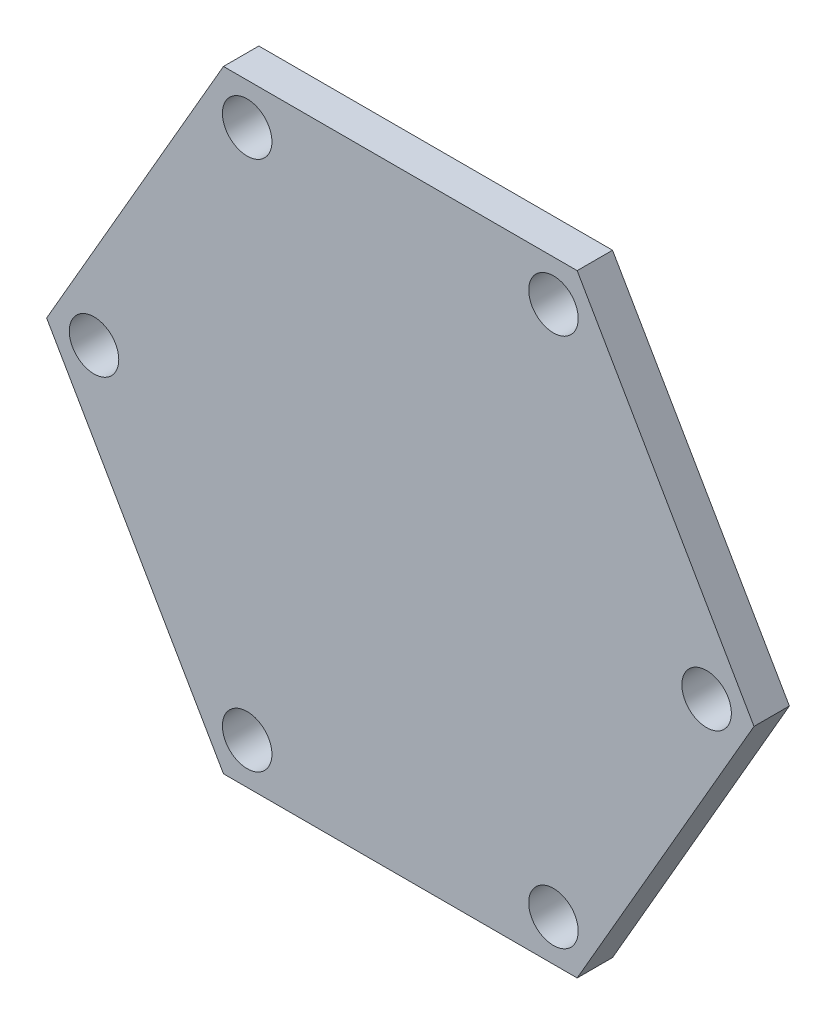
from build123d import *

# Parameters (mm, degrees)
SZKIC1_R                    = 7
DODANIE_WYCI_GNI_CIE1_DEPTH = 10


with BuildPart() as part:
    # Szkic1 → Dodanie-wyciągnięcie1 (new body)
    with BuildSketch(Plane.XY):
        Polygon((50, 86.602540378), (-50, 86.602540378), (-100, 0), (-50, -86.602540378), (50, -86.602540378), (100, 0), align=None)
        with Locations((-43.301270189, 75)):
            Circle(SZKIC1_R, mode=Mode.SUBTRACT)
        with Locations((43.301270189, 75)):
            Circle(SZKIC1_R, mode=Mode.SUBTRACT)
        with Locations((86.602540378, 0)):
            Circle(SZKIC1_R, mode=Mode.SUBTRACT)
        with Locations((43.301270189, -75)):
            Circle(SZKIC1_R, mode=Mode.SUBTRACT)
        with Locations((-43.301270189, -75)):
            Circle(SZKIC1_R, mode=Mode.SUBTRACT)
        with Locations((-86.602540378, 0)):
            Circle(SZKIC1_R, mode=Mode.SUBTRACT)
    extrude(amount=DODANIE_WYCI_GNI_CIE1_DEPTH)


solid = part.part
